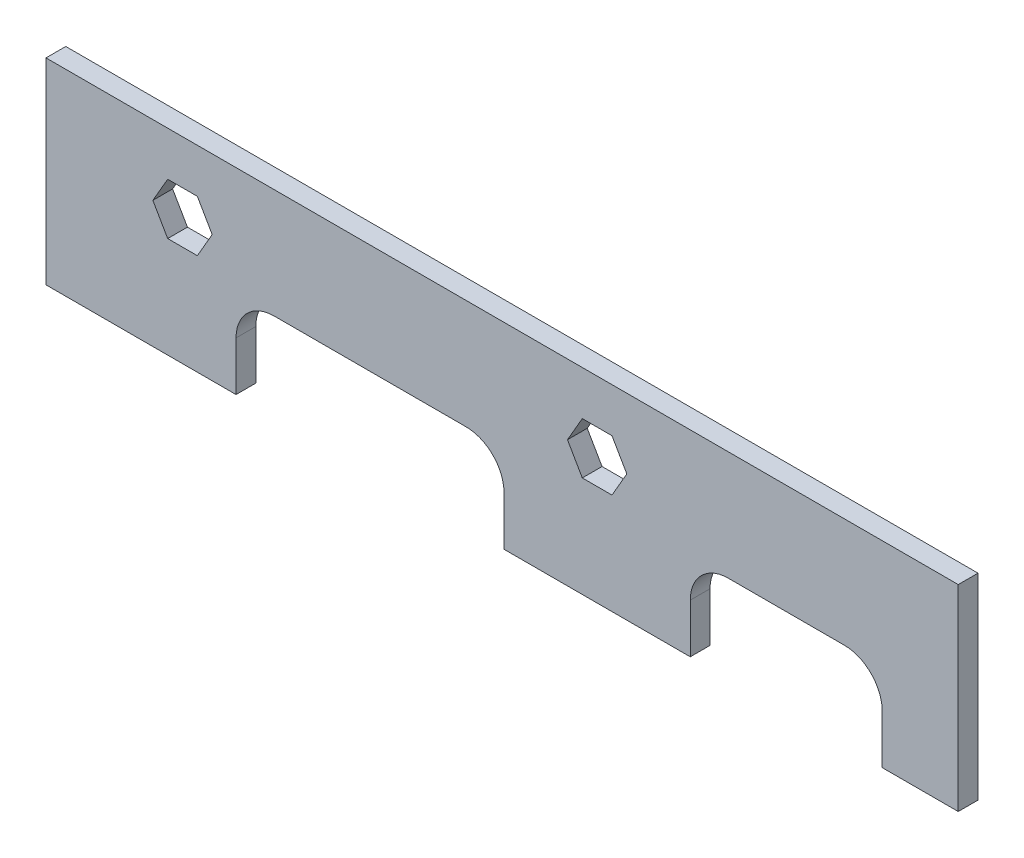
from build123d import *

# Parameters (mm, degrees)
BOSS_EXTRUDE1_DEPTH = 3.302


with BuildPart() as part:
    # Sketch1 → Boss-Extrude1 (new body)
    with BuildSketch(Plane.XY):
        with BuildLine():
            Line((8750.18528935, 2968.413177756), (8597.78528935, 2968.413177756))
            Line((8597.78528935, 2968.413177756), (8597.78528935, 2935.573517756))
            Line((8597.78528935, 2935.573517756), (8629.53528935, 2935.573517756))
            Line((8629.53528935, 2935.573517756), (8629.53528935, 2943.775177756))
            ThreePointArc((8629.53528935, 2943.775177756), (8631.39516129, 2948.265305817), (8635.88528935, 2950.125177756))
            Line((8635.88528935, 2950.125177756), (8667.95278935, 2950.125177756))
            ThreePointArc((8667.95278935, 2950.125177756), (8672.442917411, 2948.265305817), (8674.30278935, 2943.775177756))
            Line((8674.30278935, 2943.775177756), (8674.30278935, 2935.573517756))
            Line((8674.30278935, 2935.573517756), (8705.41778935, 2935.573517756))
            Line((8705.41778935, 2935.573517756), (8705.41778935, 2943.775177756))
            ThreePointArc((8705.41778935, 2943.775177756), (8707.27766129, 2948.265305817), (8711.76778935, 2950.125177756))
            Line((8711.76778935, 2950.125177756), (8731.13528935, 2950.125177756))
            ThreePointArc((8731.13528935, 2950.125177756), (8735.625417411, 2948.265305817), (8737.48528935, 2943.775177756))
            Line((8737.48528935, 2943.775177756), (8737.48528935, 2935.573517756))
            Line((8737.48528935, 2935.573517756), (8750.18528935, 2935.573517756))
            Line((8750.18528935, 2935.573517756), (8750.18528935, 2968.413177756))
        make_face()
        Polygon((8618.114658264, 2961.021777756), (8615.636324499, 2956.729177756), (8618.114658264, 2952.436577756), (8623.071325795, 2952.436577756), (8625.549659561, 2956.729177756), (8623.071325795, 2961.021777756), align=None, mode=Mode.SUBTRACT)
        Polygon((8687.381955585, 2961.021777756), (8684.903621819, 2956.729177756), (8687.381955585, 2952.436577756), (8692.338623116, 2952.436577756), (8694.816956881, 2956.729177756), (8692.338623116, 2961.021777756), align=None, mode=Mode.SUBTRACT)
    extrude(amount=BOSS_EXTRUDE1_DEPTH)


solid = part.part
